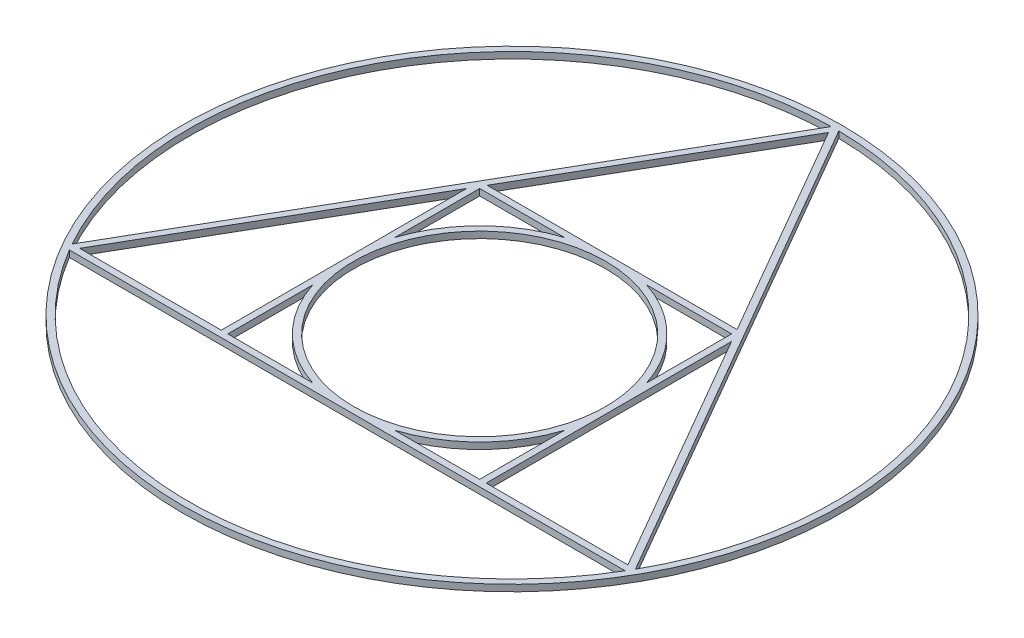
from build123d import *

# Parameters (mm, degrees)
SKETCH1_R           = 182.705
SKETCH1_R_2         = 69.823485805
BOSS_EXTRUDE4_DEPTH = 3.61


with BuildPart() as part:
    # Sketch1 → Boss-Extrude4 (new body)
    with BuildSketch(Plane(origin=(0, 0, 0), x_dir=(1, 0, 0), z_dir=(0, 1, 0))):
        with Locations(Location((0, 0, 0), (0, 0, 270))):
            Circle(SKETCH1_R)
        Polygon((-73.433485805, -87.7425), (-151.974467983, -87.7425), (-73.433485805, 48.294471609), align=None, mode=Mode.SUBTRACT)
        with BuildLine():
            Line((-22.741100842, -87.7425), (-69.823485805, -87.7425))
            Line((-69.823485805, -87.7425), (-69.823485805, -40.660115037))
            ThreePointArc((-69.823485805, -40.660115037), (-51.925315779, -69.844329974), (-22.741100842, -87.7425))
        make_face(mode=Mode.SUBTRACT)
        with Locations(Location((0, -17.919014195, 0), (0, 0, 270))):
            Circle(SKETCH1_R_2, mode=Mode.SUBTRACT)
        with BuildLine():
            ThreePointArc((154.04460318, -91.3525), (0, -179.095), (-154.04460318, -91.3525))
            Line((-154.04460318, -91.3525), (-73.433485805, -91.3525))
            Line((-73.433485805, -91.3525), (73.433485805, -91.3525))
            Line((73.433485805, -91.3525), (154.04460318, -91.3525))
        make_face(mode=Mode.SUBTRACT)
        with BuildLine():
            Line((69.823485805, -40.660115037), (69.823485805, -87.7425))
            Line((69.823485805, -87.7425), (22.741100842, -87.7425))
            ThreePointArc((22.741100842, -87.7425), (51.925315779, -69.844329974), (69.823485805, -40.660115037))
        make_face(mode=Mode.SUBTRACT)
        Polygon((151.974467983, -87.7425), (73.433485805, -87.7425), (73.433485805, 48.294471609), align=None, mode=Mode.SUBTRACT)
        with BuildLine():
            Line((-69.823485805, 51.904471609), (-22.741100842, 51.904471609))
            ThreePointArc((-22.741100842, 51.904471609), (-51.925315779, 34.006301583), (-69.823485805, 4.822086647))
            Line((-69.823485805, 4.822086647), (-69.823485805, 51.904471609))
        make_face(mode=Mode.SUBTRACT)
        with BuildLine():
            ThreePointArc((-156.135887289, -87.730289669), (-155.100819691, 89.5475), (-2.091284109, 179.082789669))
            Line((-2.091284109, 179.082789669), (-156.135887289, -87.730289669))
        make_face(mode=Mode.SUBTRACT)
        Polygon((-69.265016861, 55.514471609), (0, 175.485), (69.265016861, 55.514471609), align=None, mode=Mode.SUBTRACT)
        with BuildLine():
            Line((22.741100842, 51.904471609), (69.823485805, 51.904471609))
            Line((69.823485805, 51.904471609), (69.823485805, 4.822086647))
            ThreePointArc((69.823485805, 4.822086647), (51.925315779, 34.006301583), (22.741100842, 51.904471609))
        make_face(mode=Mode.SUBTRACT)
        with BuildLine():
            ThreePointArc((2.091284109, 179.082789669), (155.100819691, 89.5475), (156.135887289, -87.730289669))
            Line((156.135887289, -87.730289669), (2.091284109, 179.082789669))
        make_face(mode=Mode.SUBTRACT)
    extrude(amount=BOSS_EXTRUDE4_DEPTH)


solid = part.part
